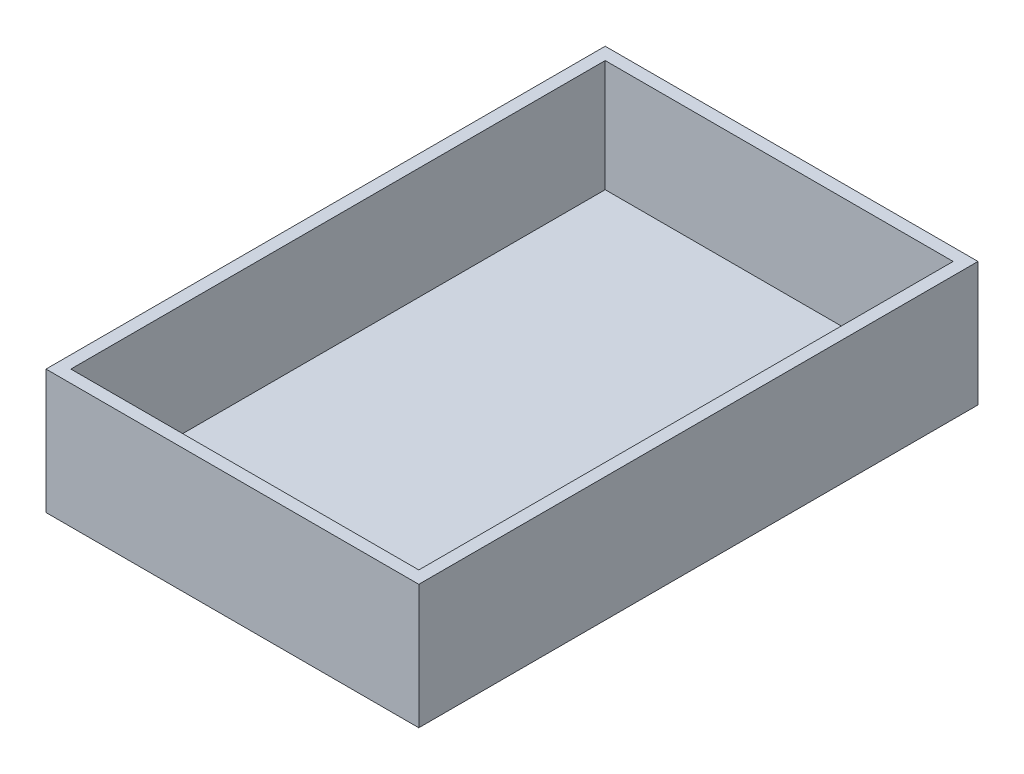
from build123d import *

# Parameters (mm, degrees)
CROQUIS1_W              = 300
CROQUIS1_H              = 100
SALIENTE_EXTRUIR1_DEPTH = 450
CROQUIS2_W              = 280
CROQUIS2_H              = 430
CORTAR_EXTRUIR1_DEPTH   = 90


with BuildPart() as part:
    # Croquis1 → Saliente-Extruir1 (new body)
    with BuildSketch(Plane.XY):
        with Locations((150, 50)):
            Rectangle(CROQUIS1_W, CROQUIS1_H)
    extrude(amount=-SALIENTE_EXTRUIR1_DEPTH)

    # Croquis2 → Cortar-Extruir1 (cut)
    with BuildSketch(Plane(origin=(0, 100, 0), x_dir=(1, 0, 0), z_dir=(0, 1, 0))):
        with Locations((150, 225)):
            Rectangle(CROQUIS2_W, CROQUIS2_H)
    extrude(amount=-CORTAR_EXTRUIR1_DEPTH, mode=Mode.SUBTRACT)


solid = part.part
